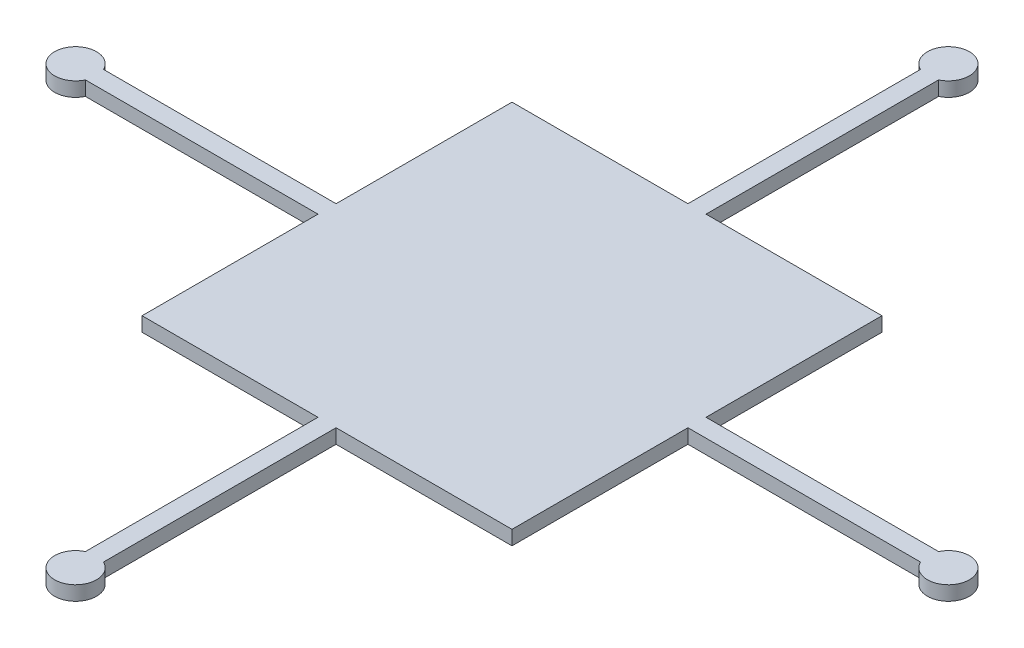
from build123d import *

# Parameters (mm, degrees)
BOSS_EXTRUDE1_DEPTH = 2.54


with BuildPart() as part:
    # Sketch1 → Boss-Extrude1 (new body)
    with BuildSketch(Plane(origin=(0, 0, 0), x_dir=(1, 0, 0), z_dir=(0, 1, 0))):
        with BuildLine():
            Line((34.356030095, 0), (65.506126721, 0))
            Line((65.506126721, 0), (65.506126721, 31.150096626))
            Line((65.506126721, 31.150096626), (106.681389714, 31.150096626))
            ThreePointArc((106.681389714, 31.150096626), (113.737222592, 32.753063361), (106.681389714, 34.356030095))
            Line((106.681389714, 34.356030095), (65.506126721, 34.356030095))
            Line((65.506126721, 34.356030095), (65.506126721, 65.506126721))
            Line((65.506126721, 65.506126721), (34.356030095, 65.506126721))
            Line((34.356030095, 65.506126721), (34.356030095, 106.681389714))
            ThreePointArc((34.356030095, 106.681389714), (32.753063361, 113.737222592), (31.150096626, 106.681389714))
            Line((31.150096626, 106.681389714), (31.150096626, 65.506126721))
            Line((31.150096626, 65.506126721), (0, 65.506126721))
            Line((0, 65.506126721), (0, 34.356030095))
            Line((0, 34.356030095), (-41.175262993, 34.356030095))
            ThreePointArc((-41.175262993, 34.356030095), (-48.231095871, 32.753063361), (-41.175262993, 31.150096626))
            Line((-41.175262993, 31.150096626), (0, 31.150096626))
            Line((0, 31.150096626), (0, 0))
            Line((0, 0), (31.150096626, 0))
            Line((31.150096626, 0), (31.150096626, -41.175262993))
            ThreePointArc((31.150096626, -41.175262993), (32.753063361, -48.231095871), (34.356030095, -41.175262993))
            Line((34.356030095, -41.175262993), (34.356030095, 0))
        make_face()
    extrude(amount=BOSS_EXTRUDE1_DEPTH)


solid = part.part
